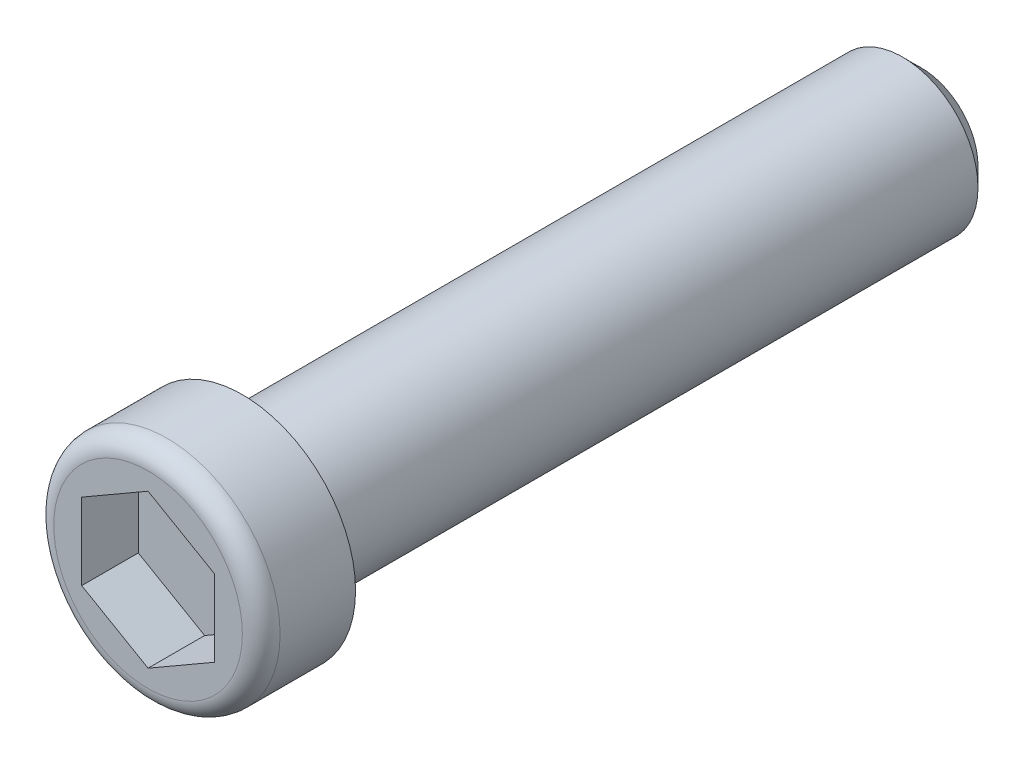
from build123d import *

# Parameters (mm, degrees)
SKETCH_1_R          = 2
EXTRUDE_1_DEPTH     = 18
SKETCH_2_R          = 3
EXTRUDE_2_DEPTH     = 2.5
CUT_EXTRUDE_1_DEPTH = 1.5
CHAMFER_1_SIZE      = 0.5
FILLET_1_R          = 0.5


with BuildPart() as part:
    # 草图1 → 凸台-拉伸1 (new body)
    with BuildSketch(Plane.XY):
        Circle(SKETCH_1_R)
    extrude(amount=EXTRUDE_1_DEPTH)

    # 草图2 → 凸台-拉伸2 (add)
    with BuildSketch(Plane.XY.offset(18)):
        Circle(SKETCH_2_R)
    extrude(amount=EXTRUDE_2_DEPTH)

    # 草图4 → 切除-拉伸1 (cut)
    with BuildSketch(Plane.XY.offset(20.5)):
        Polygon((0, 2.031649792), (-1.759460331, 1.015824896), (-1.759460331, -1.015824896), (0, -2.031649792), (1.759460331, -1.015824896), (1.759460331, 1.015824896), align=None)
    extrude(amount=-CUT_EXTRUDE_1_DEPTH, mode=Mode.SUBTRACT)

    # 倒角1
    chamfer_1_edges = [part.edges().sort_by_distance(p)[0] for p in [
        (-2, 0, 0),
    ]]
    chamfer(chamfer_1_edges, length=CHAMFER_1_SIZE)

    # 圆角1
    fillet_1_edges = [part.edges().sort_by_distance(p)[0] for p in [
        (-3, 0, 20.5),
    ]]
    fillet(fillet_1_edges, radius=FILLET_1_R)


solid = part.part
